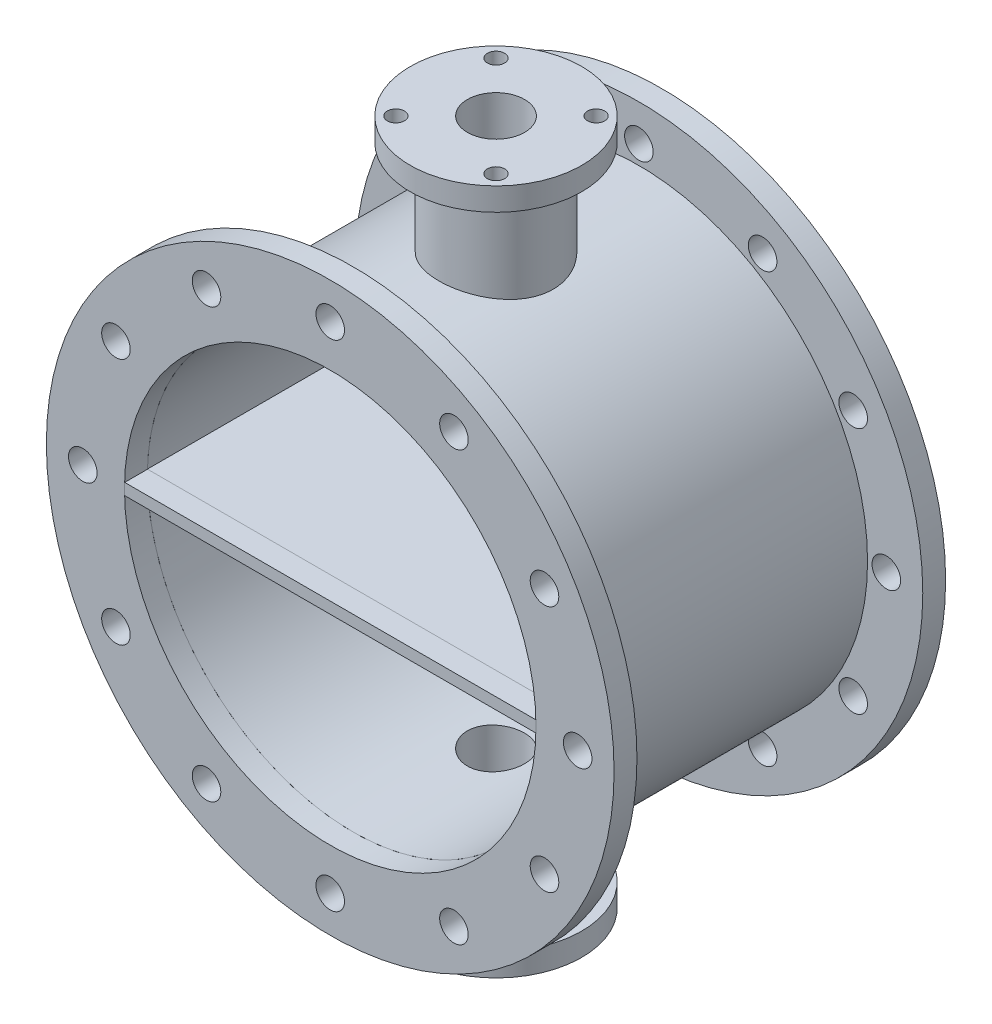
from build123d import *

# Parameters (mm, degrees)
SKETCH1_R           = 200
BOSS_EXTRUDE1_DEPTH = 250
SKETCH4_R           = 7.5
CUT_EXTRUDE1_DEPTH  = 20
SKETCH5_R           = 25
CUT_EXTRUDE2_DEPTH  = 158
CUT_EXTRUDE3_START  = -158
SKETCH6_R           = 25
CUT_EXTRUDE3_DEPTH  = 158
SKETCH7_R           = 248.300313653
SKETCH7_R_2         = 12.5
SKETCH7_R_3         = 200
SKETCH7_W           = 359.861084308
SKETCH7_H           = 10
BOSS_EXTRUDE5_DEPTH = 20
SKETCH8_R           = 248.300313653
SKETCH8_R_2         = 12.5
SKETCH8_R_3         = 200
SKETCH8_W           = 359.861084308
SKETCH8_H           = 10
BOSS_EXTRUDE7_DEPTH = 20


with BuildPart() as part:
    # Sketch1 → Boss-Extrude1 (new body)
    with BuildSketch(Plane.XY):
        Circle(SKETCH1_R)
        with BuildLine():
            Line((-179.930542154, 5), (179.930542154, 5))
            ThreePointArc((179.930542154, 5), (0, 180), (-179.930542154, 5))
        make_face(mode=Mode.SUBTRACT)
        with BuildLine():
            Line((-179.930542154, -5), (179.930542154, -5))
            ThreePointArc((179.930542154, -5), (0, -180), (-179.930542154, -5))
        make_face(mode=Mode.SUBTRACT)
    extrude(amount=BOSS_EXTRUDE1_DEPTH)

    # Sketch3 → Revolve2 (revolve)
    with BuildSketch(Plane.XY.offset(125), mode=Mode.PRIVATE) as revolve2_sk:
        Polygon((-25, 193.64916731), (-25, 300), (-75, 300), (-75, 280), (-50, 280), (-50, 193.64916731), align=None)
        Polygon((-50, -280), (-50, -193.64916731), (-25, -193.64916731), (-25, -300), (-75, -300), (-75, -280), align=None)
    revolve(revolve2_sk.sketch.rotate(Axis((0, 0, 125), (0, 1, 0)), 270), axis=Axis((0, 0, 125), (0, 1, 0)))

    # Sketch4 → Cut-Extrude1 (cut)
    with BuildSketch(Plane(origin=(0, 300, 0), x_dir=(1, 0, 0), z_dir=(0, 1, 0))):
        with Locations(Location((-43.792253438, -81.207746562, 0), (0, 0, 270))):
            Circle(SKETCH4_R)
        with Locations(Location((43.792253438, -81.207746562, 0), (0, 0, 270))):
            Circle(SKETCH4_R)
        with Locations(Location((43.792253438, -168.792253438, 0), (0, 0, 270))):
            Circle(SKETCH4_R)
        with Locations(Location((-43.792253438, -168.792253438, 0), (0, 0, 270))):
            Circle(SKETCH4_R)
    cut_extrude1 = extrude(amount=-CUT_EXTRUDE1_DEPTH, mode=Mode.SUBTRACT)

    # Mirror1: Cut-Extrude1 across plane
    add(cut_extrude1.mirror(Plane.ZX), mode=Mode.SUBTRACT)

    # Sketch5 → Cut-Extrude2 (cut)
    with BuildSketch(Plane(origin=(0, 300, 0), x_dir=(1, 0, 0), z_dir=(0, 1, 0))):
        with Locations(Location((0, -125, 0), (0, 0, 90))):
            Circle(SKETCH5_R)
    extrude(amount=-CUT_EXTRUDE2_DEPTH, mode=Mode.SUBTRACT)

    # Sketch6 → Cut-Extrude3 (cut)
    with BuildSketch(Plane.XZ.offset(300).offset(CUT_EXTRUDE3_START)):
        with Locations(Location((0, 125, 0), (0, 0, 270))):
            Circle(SKETCH6_R)
    extrude(amount=CUT_EXTRUDE3_DEPTH, mode=Mode.SUBTRACT)


with BuildPart() as body_2:
    # Sketch7 → Boss-Extrude5 (new body)
    # profile 1 of 3: a face of its own
    with BuildSketch(Plane.XY.offset(250)):
        Circle(SKETCH7_R)
        with Locations((-108.213652849, 187.431544807)):
            Circle(SKETCH7_R_2, mode=Mode.SUBTRACT)
        with Locations((-187.431544807, 108.213652849)):
            Circle(SKETCH7_R_2, mode=Mode.SUBTRACT)
        with Locations((-216.427305698, 0)):
            Circle(SKETCH7_R_2, mode=Mode.SUBTRACT)
        with Locations((-187.431544807, -108.213652849)):
            Circle(SKETCH7_R_2, mode=Mode.SUBTRACT)
        with Locations((-108.213652849, -187.431544807)):
            Circle(SKETCH7_R_2, mode=Mode.SUBTRACT)
        with Locations((0, -216.427305698)):
            Circle(SKETCH7_R_2, mode=Mode.SUBTRACT)
        with Locations((108.213652849, -187.431544807)):
            Circle(SKETCH7_R_2, mode=Mode.SUBTRACT)
        with Locations((187.431544807, -108.213652849)):
            Circle(SKETCH7_R_2, mode=Mode.SUBTRACT)
        with Locations((216.427305698, 0)):
            Circle(SKETCH7_R_2, mode=Mode.SUBTRACT)
        with Locations((187.431544807, 108.213652849)):
            Circle(SKETCH7_R_2, mode=Mode.SUBTRACT)
        with Locations((108.213652849, 187.431544807)):
            Circle(SKETCH7_R_2, mode=Mode.SUBTRACT)
        with Locations((0, 216.427305698)):
            Circle(SKETCH7_R_2, mode=Mode.SUBTRACT)
        Circle(SKETCH7_R_3, mode=Mode.SUBTRACT)
    # profile 2 of 3: a face of its own
    with BuildSketch(Plane.XY.offset(250)):
        Circle(SKETCH7_R_3)
        with BuildLine():
            ThreePointArc((179.930542154, -5), (0, -180), (-179.930542154, -5))
            ThreePointArc((-179.930542154, -5), (-180, 0), (-179.930542154, 5))
            ThreePointArc((-179.930542154, 5), (0, 180), (179.930542154, 5))
            ThreePointArc((179.930542154, 5), (179.982634701, 2.500241208), (180, 0))
            ThreePointArc((180, 0), (179.982634701, -2.500241208), (179.930542154, -5))
        make_face(mode=Mode.SUBTRACT)
    # profile 3 of 3: a face of its own
    with BuildSketch(Plane.XY.offset(250)):
        Rectangle(SKETCH7_W, SKETCH7_H)
    extrude(amount=BOSS_EXTRUDE5_DEPTH)


with BuildPart() as body_3:
    # Sketch8 → Boss-Extrude7 (new body)
    # profile 1 of 3: a face of its own
    with BuildSketch(Plane(origin=(0, 0, 0), x_dir=(-1, 0, 0), z_dir=(0, 0, -1))):
        Circle(SKETCH8_R)
        with Locations((-187.431544807, -108.213652849)):
            Circle(SKETCH8_R_2, mode=Mode.SUBTRACT)
        with Locations((-108.213652849, -187.431544807)):
            Circle(SKETCH8_R_2, mode=Mode.SUBTRACT)
        with Locations((0, -216.427305698)):
            Circle(SKETCH8_R_2, mode=Mode.SUBTRACT)
        with Locations((108.213652849, -187.431544807)):
            Circle(SKETCH8_R_2, mode=Mode.SUBTRACT)
        with Locations((187.431544807, -108.213652849)):
            Circle(SKETCH8_R_2, mode=Mode.SUBTRACT)
        with Locations((216.427305698, 0)):
            Circle(SKETCH8_R_2, mode=Mode.SUBTRACT)
        with Locations((187.431544807, 108.213652849)):
            Circle(SKETCH8_R_2, mode=Mode.SUBTRACT)
        with Locations((108.213652849, 187.431544807)):
            Circle(SKETCH8_R_2, mode=Mode.SUBTRACT)
        with Locations((0, 216.427305698)):
            Circle(SKETCH8_R_2, mode=Mode.SUBTRACT)
        with Locations((-108.213652849, 187.431544807)):
            Circle(SKETCH8_R_2, mode=Mode.SUBTRACT)
        with Locations((-187.431544807, 108.213652849)):
            Circle(SKETCH8_R_2, mode=Mode.SUBTRACT)
        with Locations((-216.427305698, 0)):
            Circle(SKETCH8_R_2, mode=Mode.SUBTRACT)
        with Locations(Location((0, 0, 0), (0, 0, 180))):
            Circle(SKETCH8_R_3, mode=Mode.SUBTRACT)
    # profile 2 of 3: a face of its own
    with BuildSketch(Plane(origin=(0, 0, 0), x_dir=(-1, 0, 0), z_dir=(0, 0, -1))):
        with Locations(Location((0, 0, 0), (0, 0, 180))):
            Circle(SKETCH8_R_3)
        with BuildLine():
            ThreePointArc((179.930542154, -5), (0, -180), (-179.930542154, -5))
            ThreePointArc((-179.930542154, -5), (-180, 0), (-179.930542154, 5))
            ThreePointArc((-179.930542154, 5), (0, 180), (179.930542154, 5))
            ThreePointArc((179.930542154, 5), (179.982634701, 2.500241208), (180, 0))
            ThreePointArc((180, 0), (179.982634701, -2.500241208), (179.930542154, -5))
        make_face(mode=Mode.SUBTRACT)
    # profile 3 of 3: a face of its own
    with BuildSketch(Plane(origin=(0, 0, 0), x_dir=(-1, 0, 0), z_dir=(0, 0, -1))):
        Rectangle(SKETCH8_W, SKETCH8_H)
    extrude(amount=BOSS_EXTRUDE7_DEPTH)


solid = Compound([part.part, body_2.part, body_3.part])
